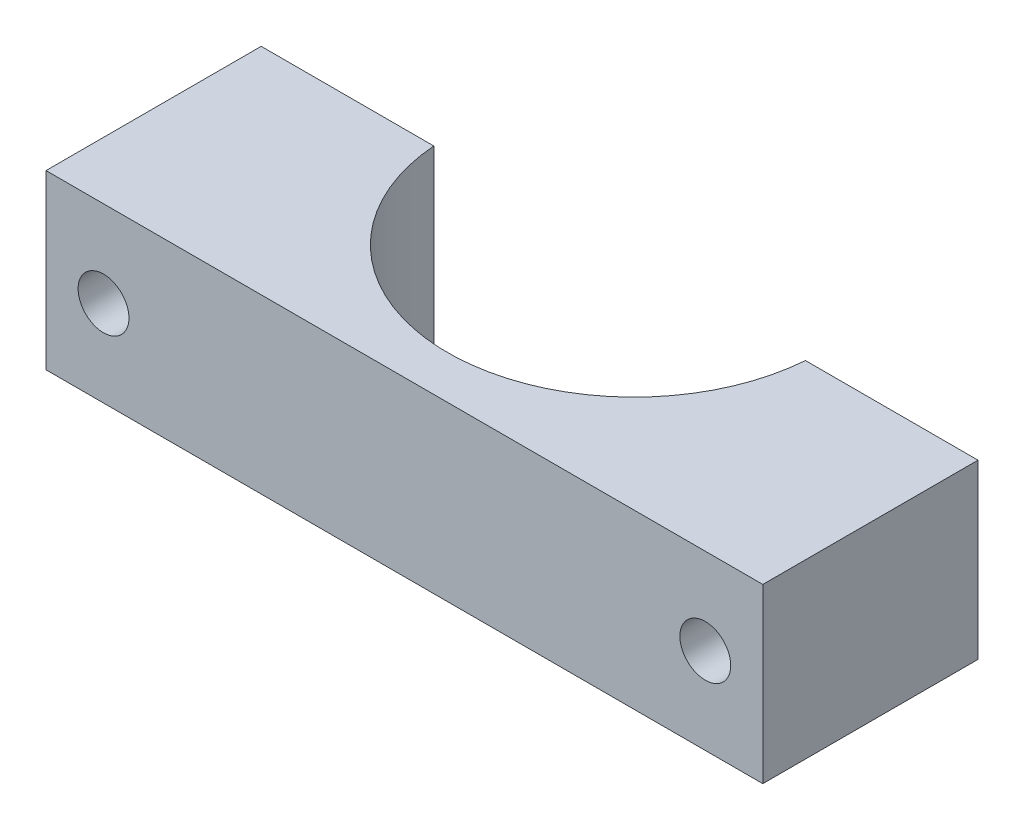
from build123d import *

# Parameters (mm, degrees)
BOSS_EXTRUDE1_DEPTH    = 19.05
SKETCH2_R              = 1.27
CUT_EXTRUDE1_DEPTH     = 50.92377848
F_10_CLEARANCE_HOLE1_D = 5.6134


with BuildPart() as part:
    # Sketch1 → Boss-Extrude1 (new body)
    with BuildSketch(Plane(origin=(0, 0, 0), x_dir=(1, 0, 0), z_dir=(0, 1, 0))):
        with BuildLine():
            Line((39.563039866, -1.582615385), (39.563039866, -25.3365))
            Line((39.563039866, -25.3365), (-39.563039866, -25.3365))
            Line((-39.563039866, -25.3365), (-39.563039866, -1.582615385))
            Line((-39.563039866, -1.582615385), (-20.513039866, -1.582615385))
            ThreePointArc((-20.513039866, -1.582615385), (0, -20.574), (20.513039866, -1.582615385))
            Line((20.513039866, -1.582615385), (39.563039866, -1.582615385))
        make_face()
    extrude(amount=BOSS_EXTRUDE1_DEPTH)

    # Sketch2 → Cut-Extrude1 (cut, through all)
    with BuildSketch(Plane.XY.offset(25.3365)):
        with Locations((33.213039866, 9.525)):
            Circle(SKETCH2_R)
        with Locations((-33.213039866, 9.525)):
            Circle(SKETCH2_R)
    extrude(amount=-CUT_EXTRUDE1_DEPTH, mode=Mode.SUBTRACT)

    # #10 Clearance Hole1 (through all)
    with Locations(Plane.XY.offset(25.3365)):
        with Locations((-33.213039866, 9.525), (33.213039866, 9.525)):
            Hole(F_10_CLEARANCE_HOLE1_D / 2)


solid = part.part
